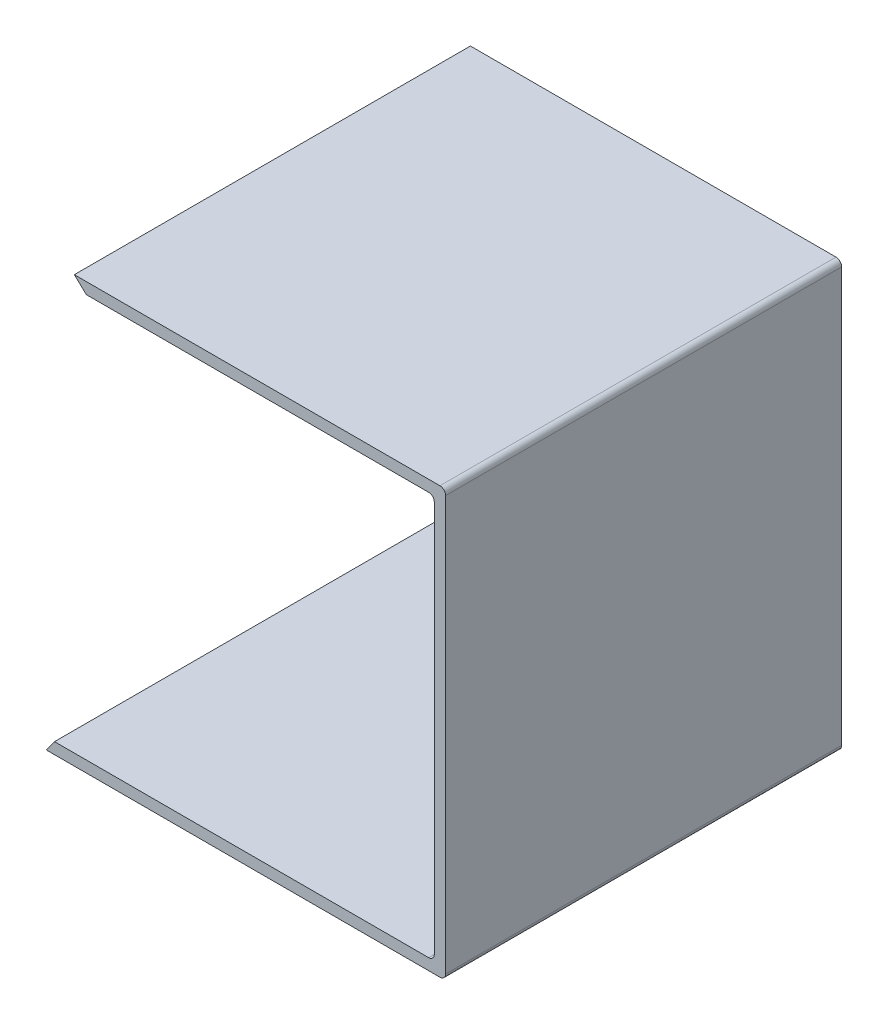
from build123d import *

# Parameters (mm, degrees)
RESSALTO_EXTRUS_O1_DEPTH = 140


with BuildPart() as part:
    # Esboço1 → Ressalto-extrusão1 (new body)
    with BuildSketch(Plane.XY):
        with BuildLine():
            Line((0, 0), (2.890200696, 4))
            Line((2.890200696, 4), (135.13, 4))
            ThreePointArc((135.13, 4), (136.544213562, 4.585786438), (137.13, 6))
            Line((137.13, 6), (137.13, 144.45))
            ThreePointArc((137.13, 144.45), (136.544213562, 145.864213562), (135.13, 146.45))
            Line((135.13, 146.45), (14.13, 146.45))
            Line((14.13, 146.45), (9.894198974, 150.45))
            Line((9.894198974, 150.45), (139.13, 150.45))
            ThreePointArc((139.13, 150.45), (140.544213562, 149.864213562), (141.13, 148.45))
            Line((141.13, 148.45), (141.13, 2))
            ThreePointArc((141.13, 2), (140.544213562, 0.585786438), (139.13, 0))
            Line((139.13, 0), (0, 0))
        make_face()
    extrude(amount=RESSALTO_EXTRUS_O1_DEPTH)


solid = part.part
